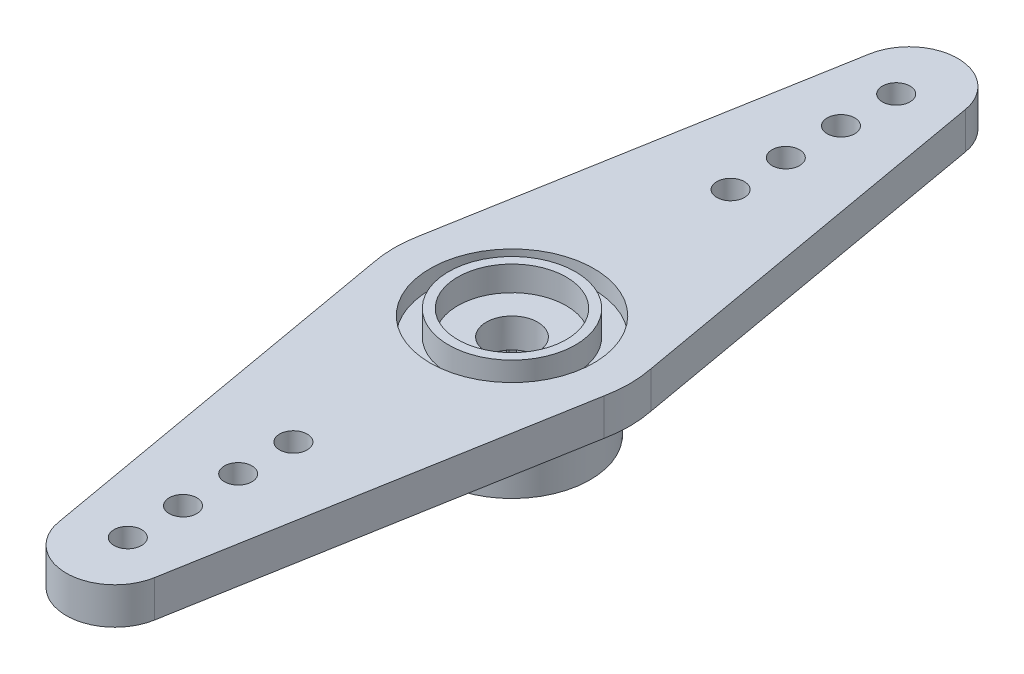
from build123d import *

# Parameters (mm, degrees)
SKETCH1_R               = 6.4
BOSS_EXTRUDE1_DEPTH     = 5.6
HORN_START              = -2
HORN_DEPTH              = 2
SKETCH4_R               = 1.4
CUT_EXTRUDE1_DEPTH      = 26.681786257
SKETCH5_R               = 0.75
CUT_EXTRUDE2_DEPTH      = 26.681786257
LPATTERN1_COUNT         = 4
LPATTERN1_PITCH         = 3
MIRROR1_COPY_1_SKETCH_R = 0.75
MIRROR1_COPY_1_DEPTH    = 26.681786257
MIRROR1_COPY_2_SKETCH_R = 0.75
MIRROR1_COPY_2_DEPTH    = 26.681786257
MIRROR1_COPY_3_SKETCH_R = 0.75
MIRROR1_COPY_3_DEPTH    = 26.681786257
CUT_EXTRUDE4_DEPTH      = 3
CIRPATTERN2_COUNT       = 26
SKETCH9_R               = 2.6
CUT_EXTRUDE5_DEPTH      = 3
SKETCH10_R              = 6.4
SKETCH10_R_2            = 4.25
CUT_EXTRUDE6_DEPTH      = 3.6
SKETCH12_R              = 4.45
CUT_EXTRUDE7_DEPTH      = 1
SKETCH13_R              = 3.45
SKETCH13_R_2            = 2.95
BOSS_EXTRUDE6_DEPTH     = 1
SKETCH14_R              = 3.45
SKETCH14_R_2            = 2.95
BOSS_EXTRUDE7_DEPTH     = 0.35


with BuildPart() as part:
    # Sketch1 → Boss-Extrude1 (new body)
    with BuildSketch(Plane(origin=(0, 0, 0), x_dir=(1, 0, 0), z_dir=(0, 1, 0))):
        with Locations(Location((0, 0, 0), (0, 0, 270))):
            Circle(SKETCH1_R)
    extrude(amount=BOSS_EXTRUDE1_DEPTH)

    # Sketch2 → horn (add)
    with BuildSketch(Plane(origin=(0, 5.6, 0), x_dir=(1, 0, 0), z_dir=(0, 1, 0)).offset(HORN_START)):
        with BuildLine():
            Line((-2.609740545, 22.043082174), (-6.271723477, 1.27494495))
            ThreePointArc((-6.271723477, 1.27494495), (0, 6.4), (6.271723477, 1.27494495))
            Line((6.271723477, 1.27494495), (2.609740545, 22.043082174))
            ThreePointArc((2.609740545, 22.043082174), (0, 24.232914504), (-2.609740545, 22.043082174))
        make_face()
    horn = extrude(amount=HORN_DEPTH)

    # Sketch4 → Cut-Extrude1 (cut, through all)
    with BuildSketch(Plane(origin=(0, 5.6, 0), x_dir=(-1, 0, 0), z_dir=(0, -1, 0))):
        with Locations(Location((0, 0, 0), (0, 0, 90))):
            Circle(SKETCH4_R)
    extrude(amount=CUT_EXTRUDE1_DEPTH, mode=Mode.SUBTRACT)

    # Sketch5 → Cut-Extrude2 (cut, through all)
    with BuildSketch(Plane(origin=(0, 0, 0), x_dir=(-1, 0, 0), z_dir=(0, -1, 0))):
        with Locations(Location((0, 20.882914504, 0), (0, 0, 90))):
            Circle(SKETCH5_R)
    cut_extrude2 = extrude(amount=-CUT_EXTRUDE2_DEPTH, mode=Mode.SUBTRACT)

    # LPattern1: Cut-Extrude2 ×4
    with Locations(*[(0, 0, i * LPATTERN1_PITCH) for i in range(1, LPATTERN1_COUNT)]):
        add(cut_extrude2, mode=Mode.SUBTRACT)

    # Mirror1: horn, Cut-Extrude2 across plane
    add(horn.mirror(Plane.XY))
    add(cut_extrude2.mirror(Plane.XY), mode=Mode.SUBTRACT)

    # Mirror1 copy 1 sketch → Mirror1 copy 1 (cut, through all)
    with BuildSketch(Plane(origin=(0, 0, -3), x_dir=(-1, 0, 0), z_dir=(0, -1, 0))):
        with Locations((0, -20.882914504)):
            Circle(MIRROR1_COPY_1_SKETCH_R)
    extrude(amount=-MIRROR1_COPY_1_DEPTH, mode=Mode.SUBTRACT)

    # Mirror1 copy 2 sketch → Mirror1 copy 2 (cut, through all)
    with BuildSketch(Plane(origin=(0, 0, -6), x_dir=(-1, 0, 0), z_dir=(0, -1, 0))):
        with Locations((0, -20.882914504)):
            Circle(MIRROR1_COPY_2_SKETCH_R)
    extrude(amount=-MIRROR1_COPY_2_DEPTH, mode=Mode.SUBTRACT)

    # Mirror1 copy 3 sketch → Mirror1 copy 3 (cut, through all)
    with BuildSketch(Plane(origin=(0, 0, -9), x_dir=(-1, 0, 0), z_dir=(0, -1, 0))):
        with Locations((0, -20.882914504)):
            Circle(MIRROR1_COPY_3_SKETCH_R)
    extrude(amount=-MIRROR1_COPY_3_DEPTH, mode=Mode.SUBTRACT)

    # Sketch8 → Cut-Extrude4 (cut)
    with BuildSketch(Plane(origin=(0, 0, 0), x_dir=(-1, 0, 0), z_dir=(0, -1, 0))):
        with BuildLine():
            Line((0, -2.9), (0.262912611, -2.586672952))
            ThreePointArc((0.262912611, -2.586672952), (0, -2.6), (-0.262912611, -2.586672952))
            Line((-0.262912611, -2.586672952), (0, -2.9))
        make_face()
    cut_extrude4 = extrude(amount=-CUT_EXTRUDE4_DEPTH, mode=Mode.SUBTRACT)

    # CirPattern2: Cut-Extrude4 ×26 about axis
    cirpattern2_axis = Axis((0, 0, 0), (0, 1, 0))
    for i in range(1, CIRPATTERN2_COUNT):
        add(cut_extrude4.rotate(cirpattern2_axis, i * 360 / CIRPATTERN2_COUNT), mode=Mode.SUBTRACT)

    # Sketch9 → Cut-Extrude5 (cut)
    with BuildSketch(Plane(origin=(0, 0, 0), x_dir=(-1, 0, 0), z_dir=(0, -1, 0))):
        Circle(SKETCH9_R)
    extrude(amount=-CUT_EXTRUDE5_DEPTH, mode=Mode.SUBTRACT)

    # Sketch10 → Cut-Extrude6 (cut)
    with BuildSketch(Plane(origin=(0, 0, 0), x_dir=(-1, 0, 0), z_dir=(0, -1, 0))):
        Circle(SKETCH10_R)
        with Locations(Location((0, 0, 0), (0, 0, 90))):
            Circle(SKETCH10_R_2, mode=Mode.SUBTRACT)
    extrude(amount=-CUT_EXTRUDE6_DEPTH, mode=Mode.SUBTRACT)

    # Sketch12 → Cut-Extrude7 (cut)
    with BuildSketch(Plane(origin=(0, 5.6, 0), x_dir=(1, 0, 0), z_dir=(0, 1, 0))):
        with Locations(Location((0, 0, 0), (0, 0, 270))):
            Circle(SKETCH12_R)
    extrude(amount=-CUT_EXTRUDE7_DEPTH, mode=Mode.SUBTRACT)

    # Sketch13 → Boss-Extrude6 (add)
    with BuildSketch(Plane(origin=(0, 4.6, 0), x_dir=(1, 0, 0), z_dir=(0, 1, 0))):
        with Locations(Location((0, 0, 0), (0, 0, 90))):
            Circle(SKETCH13_R)
        with Locations(Location((0, 0, 0), (0, 0, 90))):
            Circle(SKETCH13_R_2, mode=Mode.SUBTRACT)
    extrude(amount=BOSS_EXTRUDE6_DEPTH)

    # Sketch14 → Boss-Extrude7 (add)
    with BuildSketch(Plane(origin=(0, 5.6, 0), x_dir=(1, 0, 0), z_dir=(0, 1, 0))):
        with Locations(Location((0, 0, 0), (0, 0, 90))):
            Circle(SKETCH14_R)
        with Locations(Location((0, 0, 0), (0, 0, 90))):
            Circle(SKETCH14_R_2, mode=Mode.SUBTRACT)
    extrude(amount=BOSS_EXTRUDE7_DEPTH)


solid = part.part
